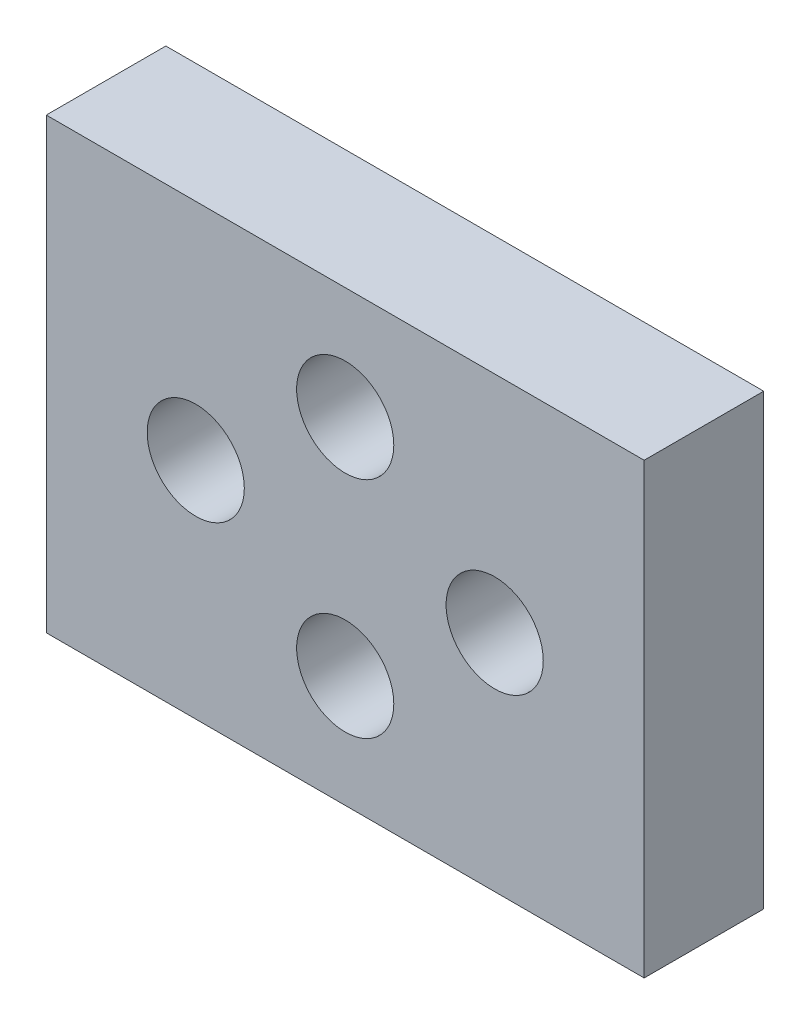
from build123d import *

# Parameters (mm, degrees)
SKETCH1_W           = 40
SKETCH1_H           = 30
BOSS_EXTRUDE1_DEPTH = 8
SKETCH2_R           = 3.25
CUT_EXTRUDE1_DEPTH  = 27.248809497


with BuildPart() as part:
    # Sketch1 → Boss-Extrude1 (new body)
    with BuildSketch(Plane.XY):
        Rectangle(SKETCH1_W, SKETCH1_H)
    extrude(amount=BOSS_EXTRUDE1_DEPTH)

    # Sketch2 → Cut-Extrude1 (cut, through all)
    with BuildSketch(Plane.XY.offset(8)):
        with Locations((-10, 0)):
            Circle(SKETCH2_R)
        with Locations((10, 0)):
            Circle(SKETCH2_R)
        with Locations((0, 7.5)):
            Circle(SKETCH2_R)
        with Locations((0, -7.5)):
            Circle(SKETCH2_R)
    extrude(amount=-CUT_EXTRUDE1_DEPTH, mode=Mode.SUBTRACT)


solid = part.part
